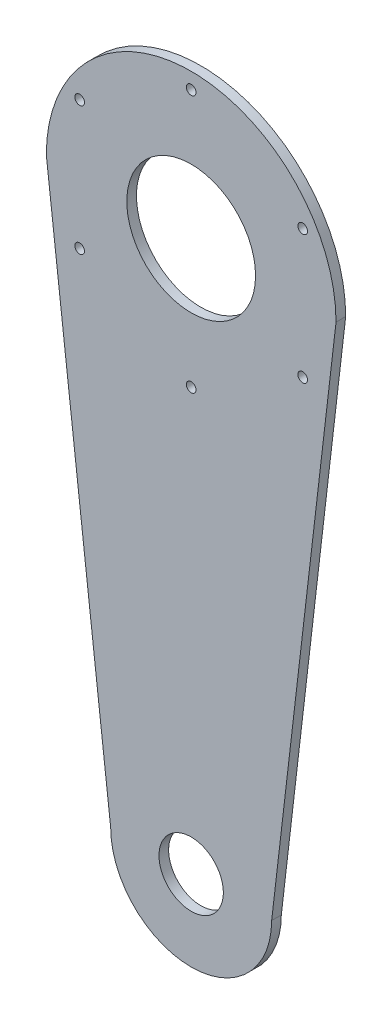
from build123d import *

# Parameters (mm, degrees)
SKETCH1_R           = 10
SKETCH1_R_2         = 1.5
SKETCH1_R_3         = 20
BOSS_EXTRUDE1_DEPTH = 3


with BuildPart() as part:
    # Sketch1 → Boss-Extrude1 (new body)
    with BuildSketch(Plane.XY):
        with BuildLine():
            ThreePointArc((45, 0), (0, 45), (-45, 0))
            Line((-45, 0), (-43.785466077, -10.384265038))
            Line((-43.785466077, -10.384265038), (-25, -171))
            ThreePointArc((-25, -171), (0, -196), (25, -171))
            Line((25, -171), (43.785466077, -10.384265038))
            Line((43.785466077, -10.384265038), (45, 0))
        make_face()
        with Locations((0, -171)):
            Circle(SKETCH1_R, mode=Mode.SUBTRACT)
        with Locations((-34.641016151, -20)):
            Circle(SKETCH1_R_2, mode=Mode.SUBTRACT)
        with Locations((0, -40)):
            Circle(SKETCH1_R_2, mode=Mode.SUBTRACT)
        with Locations((-34.641016151, 20)):
            Circle(SKETCH1_R_2, mode=Mode.SUBTRACT)
        Circle(SKETCH1_R_3, mode=Mode.SUBTRACT)
        with Locations((0, 40)):
            Circle(SKETCH1_R_2, mode=Mode.SUBTRACT)
        with Locations((34.641016151, -20)):
            Circle(SKETCH1_R_2, mode=Mode.SUBTRACT)
        with Locations((34.641016151, 20)):
            Circle(SKETCH1_R_2, mode=Mode.SUBTRACT)
    extrude(amount=BOSS_EXTRUDE1_DEPTH)


solid = part.part
